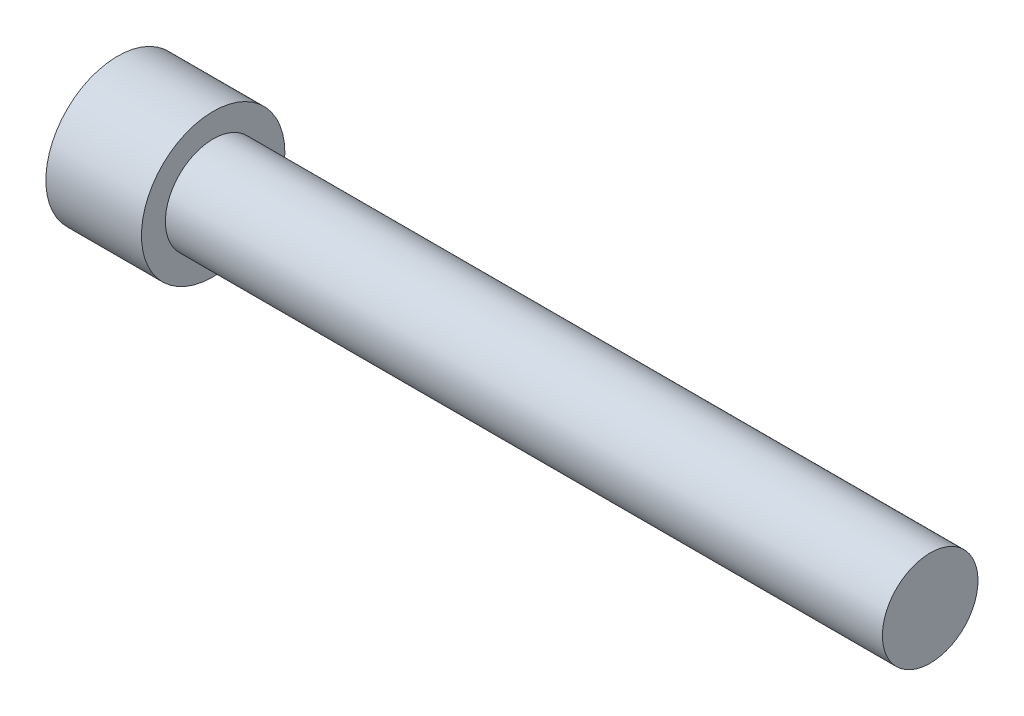
from build123d import *

# Parameters (mm, degrees)
SKETCH_1_R      = 3
EXTRUDE_1_DEPTH = 4
SKETCH_2_R      = 2
EXTRUDE_2_DEPTH = 30


with BuildPart() as part:
    # 草图1 → 凸台-拉伸1 (new body)
    with BuildSketch(Plane(origin=(0, 0, 0), x_dir=(0, 0, -1), z_dir=(1, 0, 0))):
        Circle(SKETCH_1_R)
    extrude(amount=EXTRUDE_1_DEPTH)

    # 草图2 → 凸台-拉伸2 (add)
    with BuildSketch(Plane(origin=(4, 0, 0), x_dir=(0, 0, -1), z_dir=(1, 0, 0))):
        Circle(SKETCH_2_R)
    extrude(amount=EXTRUDE_2_DEPTH)


solid = part.part
